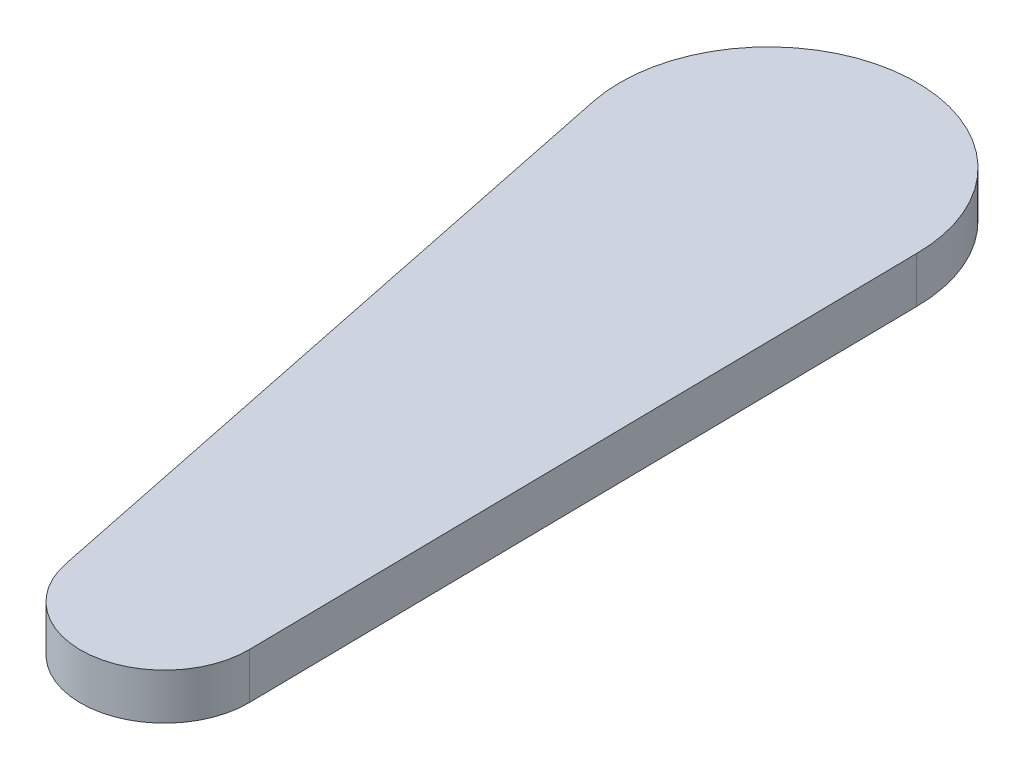
from build123d import *

# Parameters (mm, degrees)
DODANIE_WYCI_GNI_CIE1_DEPTH = 2


with BuildPart() as part:
    # Szkic2 → Dodanie-wyciągnięcie1 (new body)
    with BuildSketch(Plane(origin=(0, 390.89227062, 0), x_dir=(1, 0, 0), z_dir=(0, 1, 0))):
        with BuildLine():
            Line((226.006953366, 1606.136530313), (231.95892543, 1577.200666413))
            ThreePointArc((231.95892543, 1577.200666413), (235.928878672, 1574.307472912), (239.183723613, 1577.986750257))
            Line((239.183723613, 1577.986750257), (238.774684564, 1607.436058114))
            ThreePointArc((238.774684564, 1607.436058114), (231.671563683, 1613.852905714), (226.006953366, 1606.136530313))
        make_face()
    extrude(amount=DODANIE_WYCI_GNI_CIE1_DEPTH)


solid = part.part
